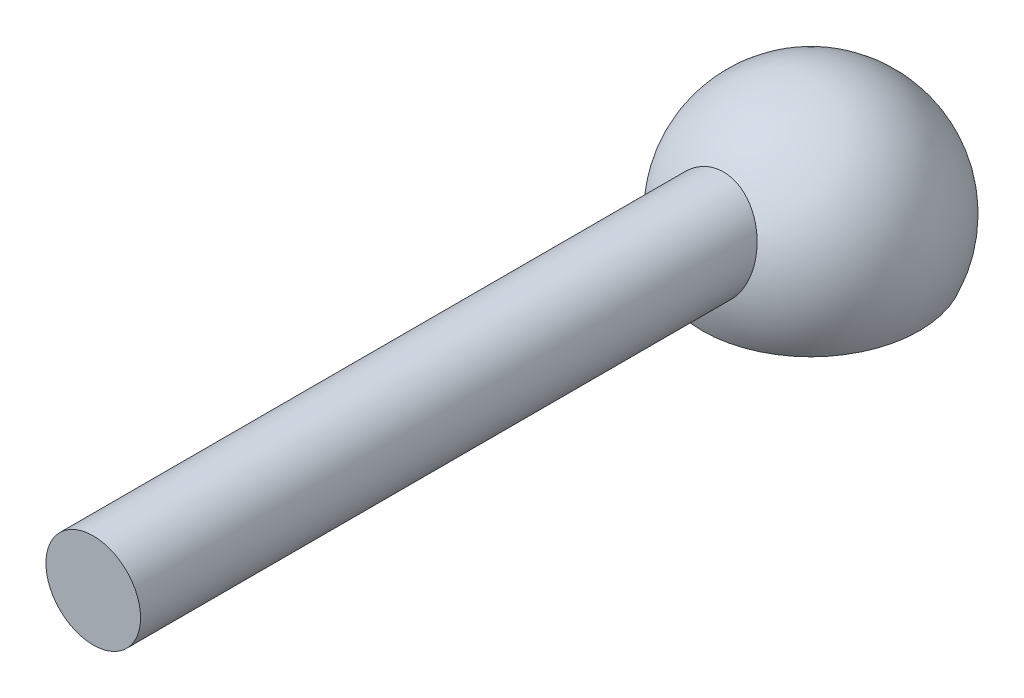
from build123d import *

# Parameters (mm, degrees)
SKETCH2_R           = 6
BOSS_EXTRUDE1_DEPTH = 91


with BuildPart() as part:
    # Sketch1 → Revolve1 (revolve)
    with BuildSketch(Plane.XY, mode=Mode.PRIVATE) as revolve1_sk:
        with BuildLine():
            ThreePointArc((37.312583507, 16), (28.368311597, 10.472135955), (29.312583507, 0))
            Line((29.312583507, 0), (23.564856422, 0))
            ThreePointArc((23.564856422, 0), (24.762683109, 14.215838363), (37.312583507, 21))
            Line((37.312583507, 21), (37.312583507, 16))
        make_face()
    revolve(revolve1_sk.sketch.rotate(Axis((37.312583507, 21, 0), (0, -1, 0)), 180), axis=Axis((37.312583507, 21, 0), (0, -1, 0)))

    # Sketch2 → Boss-Extrude1 (add)
    with BuildSketch(Plane.XY):
        with Locations(Location((37.312583507, 10.123565848, 0), (0, 0, 211.358745585))):
            Circle(SKETCH2_R)
    extrude(amount=BOSS_EXTRUDE1_DEPTH)


solid = part.part
